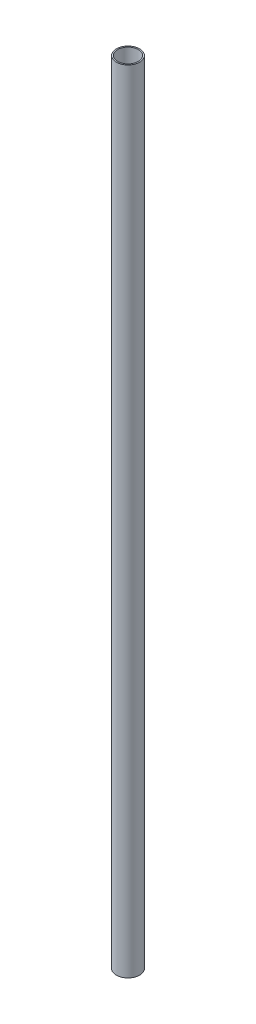
from build123d import *

# Parameters (mm, degrees)
SKETCH2_R           = 7.9375
SKETCH2_R_2         = 7.0485
BOSS_EXTRUDE1_DEPTH = 539.75


with BuildPart() as part:
    # Sketch2 → Boss-Extrude1 (new body)
    with BuildSketch(Plane(origin=(0, 0, 0), x_dir=(1, 0, 0), z_dir=(0, 1, 0))):
        with Locations(Location((0, 0, 0), (0, 0, 270))):
            Circle(SKETCH2_R)
        with Locations(Location((0, 0, 0), (0, 0, 270))):
            Circle(SKETCH2_R_2, mode=Mode.SUBTRACT)
    extrude(amount=BOSS_EXTRUDE1_DEPTH)


solid = part.part
